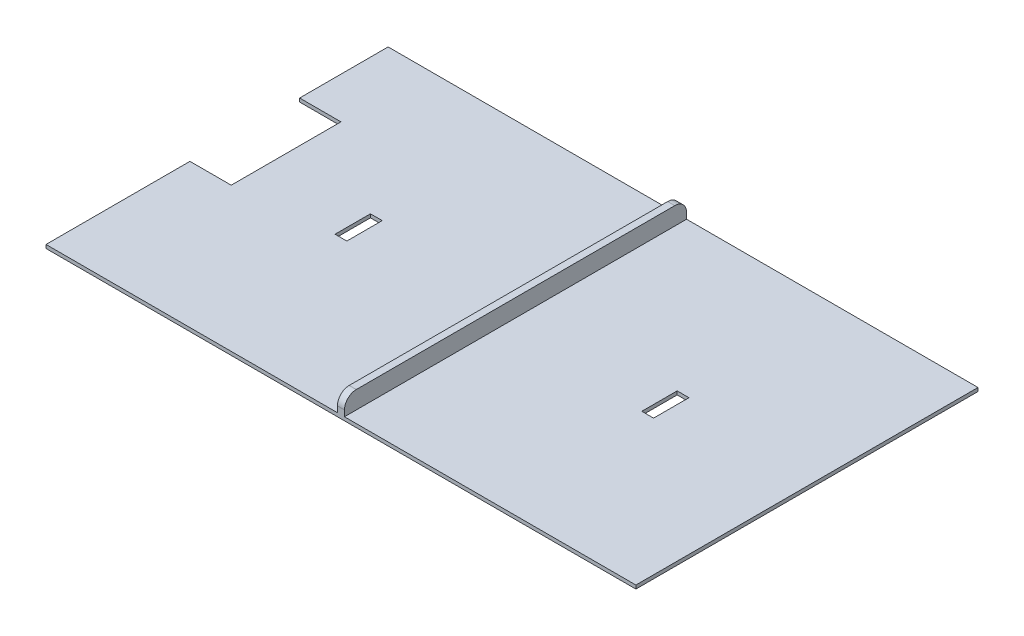
from build123d import *

# Parameters (mm, degrees)
BOSS_EXTRUDE1_DEPTH = 3
SKETCH2_W           = 10
SKETCH2_H           = 30
CUT_EXTRUDE1_DEPTH  = 3
SKETCH3_W           = 6
SKETCH3_H           = 290
BOSS_EXTRUDE2_DEPTH = 15
FILLET1_R           = 10


with BuildPart() as part:
    # Sketch1 → Boss-Extrude1 (new body)
    with BuildSketch(Plane(origin=(0, 0, 0), x_dir=(1, 0, 0), z_dir=(0, 1, 0))):
        Polygon((-250, -145), (250, -145), (250, 145), (-250, 145), (-250, 70), (-215, 70), (-215, -23), (-250, -23), align=None)
    extrude(amount=BOSS_EXTRUDE1_DEPTH)

    # Sketch2 → Cut-Extrude1 (cut)
    with BuildSketch(Plane(origin=(0, 3, 0), x_dir=(1, 0, 0), z_dir=(0, 1, 0))):
        with Locations((130, 0)):
            Rectangle(SKETCH2_W, SKETCH2_H)
        with Locations((-130, 0)):
            Rectangle(SKETCH2_W, SKETCH2_H)
    extrude(amount=-CUT_EXTRUDE1_DEPTH, mode=Mode.SUBTRACT)

    # Sketch3 → Boss-Extrude2 (add)
    with BuildSketch(Plane(origin=(0, 3, 0), x_dir=(1, 0, 0), z_dir=(0, 1, 0))):
        Rectangle(SKETCH3_W, SKETCH3_H)
    extrude(amount=BOSS_EXTRUDE2_DEPTH)

    # Fillet1
    fillet1_edges = [part.edges().sort_by_distance(p)[0] for p in [
        (0, 18, -145),
        (0, 18, 145),
    ]]
    fillet(fillet1_edges, radius=FILLET1_R)


solid = part.part
